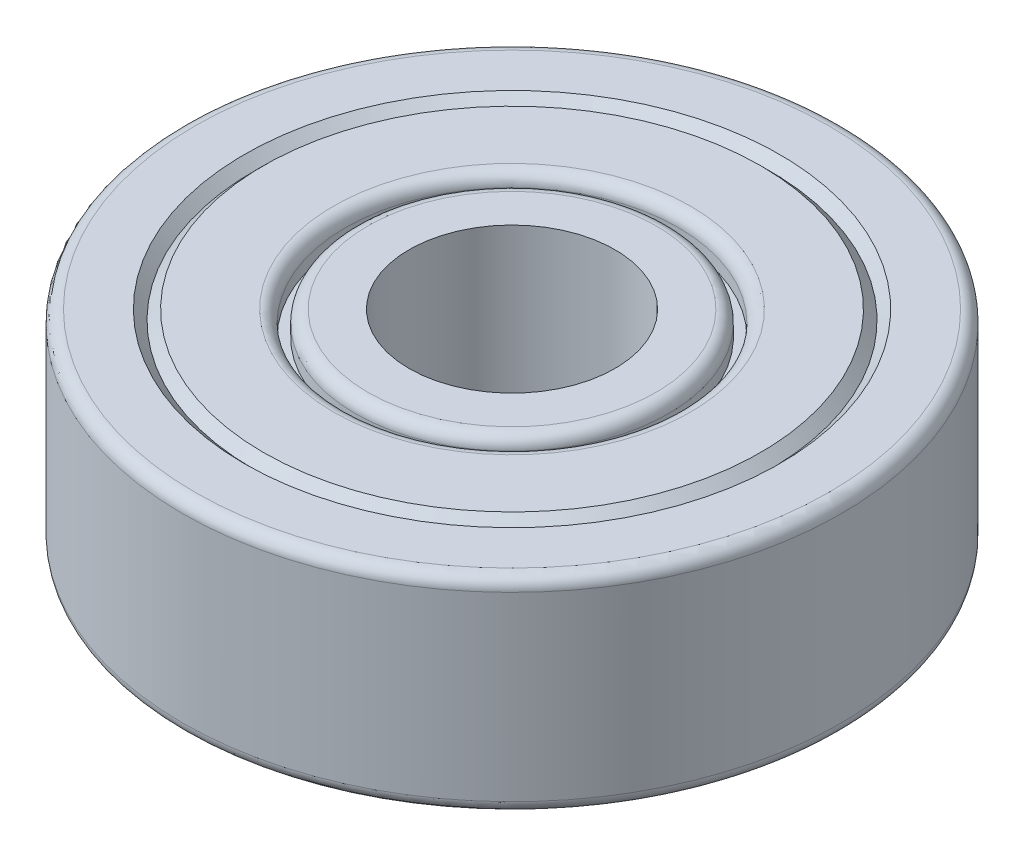
from build123d import *

# Parameters (mm, degrees)
FILLET1_R = 0.3


with BuildPart() as part:
    # Sketch1 → Revolve1 (revolve)
    with BuildSketch(Plane.XY, mode=Mode.PRIVATE) as revolve1_sk:
        Polygon((-2.5, -3.685897436), (-2.5, -8.685897436), (-3.8, -8.685897436), (-3.8, -8.085897436), (-4.032831492, -8.085897436), (-4.032831492, -8.685897436), (-6.032831492, -8.685897436), (-6.266415746, -8.452313182), (-6.5, -8.685897436), (-8, -8.685897436), (-8, -3.685897436), (-6.5, -3.685897436), (-6.266415746, -3.91948169), (-6.032831492, -3.685897436), (-4.032831492, -3.685897436), (-4.032831492, -4.285897436), (-3.8, -4.285897436), (-3.8, -3.685897436), align=None)
    revolve(revolve1_sk.sketch.rotate(Axis((0, 0, 0), (0, -1, 0)), 270), axis=Axis((0, 0, 0), (0, -1, 0)))

    # Fillet1
    fillet1_edges = [part.edges().sort_by_distance(p)[0] for p in [
        (0, -3.685897436, -3.8),
        (0, -3.685897436, -4.032831492),
        (0, -3.685897436, -8),
        (0, -8.685897436, -8),
        (0, -8.685897436, -4.032831492),
        (0, -8.685897436, -3.8),
    ]]
    fillet(fillet1_edges, radius=FILLET1_R)


solid = part.part
